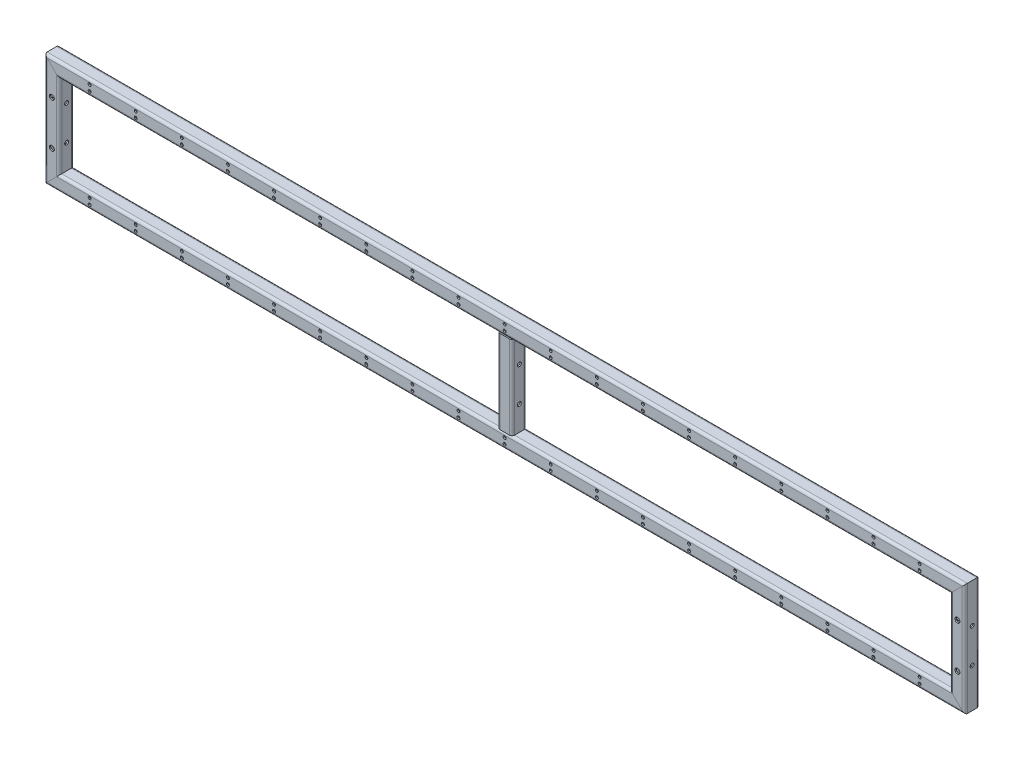
from build123d import *

# Parameters (mm, degrees)
STRUCTURAL_MEMBER1_DEPTH      = 222.213203436
STRUCTURAL_MEMBER1_DEPTH_BACK = 22.213203436
STRUCTURAL_MEMBER1_2_DEPTH    = 1890.426406871
STRUCTURAL_MEMBER1_3_DEPTH    = 244.426406871
STRUCTURAL_MEMBER1_4_DEPTH    = 1890.426406871
STRUCTURAL_MEMBER2_DEPTH      = 200
SKETCH13_R                    = 3
SKETCH13_R_2                  = 3.001929864
CUT_EXTRUDE1_DEPTH            = 1922.588145259
LPATTERN1_COUNT               = 19
LPATTERN1_PITCH               = 94
SKETCH15_R                    = 5
CUT_EXTRUDE2_DEPTH            = 1922.588145259
SKETCH17_R                    = 4
CUT_EXTRUDE3_DEPTH            = 1922.41250126


with BuildPart() as part:
    # Sketch11 → Structural Member1 (new, two sides: drawn at the far end of the back side and taken through both)
    with BuildSketch(Plane(origin=(-1861, -200, 0), x_dir=(1, 0, 0), z_dir=(0, -1, 0)).offset(-STRUCTURAL_MEMBER1_DEPTH_BACK)):
        with BuildLine():
            Line((-9.8, -15), (9.8, -15))
            ThreePointArc((9.8, -15), (13.476955262, -13.476955262), (15, -9.8))
            Line((15, -9.8), (15, 9.8))
            ThreePointArc((15, 9.8), (13.476955262, 13.476955262), (9.8, 15))
            Line((9.8, 15), (-9.8, 15))
            ThreePointArc((-9.8, 15), (-13.476955262, 13.476955262), (-15, 9.8))
            Line((-15, 9.8), (-15, -9.8))
            ThreePointArc((-15, -9.8), (-13.476955262, -13.476955262), (-9.8, -15))
        make_face()
        with BuildLine():
            Line((-9.8, -12.4), (9.8, -12.4))
            ThreePointArc((9.8, -12.4), (11.638477631, -11.638477631), (12.4, -9.8))
            Line((12.4, -9.8), (12.4, 9.8))
            ThreePointArc((12.4, 9.8), (11.638477631, 11.638477631), (9.8, 12.4))
            Line((9.8, 12.4), (-9.8, 12.4))
            ThreePointArc((-9.8, 12.4), (-11.638477631, 11.638477631), (-12.4, 9.8))
            Line((-12.4, 9.8), (-12.4, -9.8))
            ThreePointArc((-12.4, -9.8), (-11.638477631, -11.638477631), (-9.8, -12.4))
        make_face(mode=Mode.SUBTRACT)
    extrude(amount=STRUCTURAL_MEMBER1_DEPTH + STRUCTURAL_MEMBER1_DEPTH_BACK)

    # Structural Member1 mitre 1
    split(bisect_by=Plane(origin=(-1861, -200, 0), x_dir=(0.707106781, -0.707106781, 0), z_dir=(-0.707106781, -0.707106781, 0)), keep=Keep.TOP)

    # Structural Member1 mitre 2
    split(bisect_by=Plane(origin=(-1861, -400, 0), x_dir=(-0.707106781, -0.707106781, 0), z_dir=(-0.707106781, 0.707106781, 0)), keep=Keep.TOP)


with BuildPart() as body_2:
    # Sketch11 on segment 2 (carried to segment 2) → Structural Member1 2 (new body)
    with BuildSketch(Plane(origin=(-1883.213203436, -400, 0), x_dir=(0, 1, 0), z_dir=(1, 0, 0))):
        with BuildLine():
            Line((-9.8, -15), (9.8, -15))
            ThreePointArc((9.8, -15), (13.476955262, -13.476955262), (15, -9.8))
            Line((15, -9.8), (15, 9.8))
            ThreePointArc((15, 9.8), (13.476955262, 13.476955262), (9.8, 15))
            Line((9.8, 15), (-9.8, 15))
            ThreePointArc((-9.8, 15), (-13.476955262, 13.476955262), (-15, 9.8))
            Line((-15, 9.8), (-15, -9.8))
            ThreePointArc((-15, -9.8), (-13.476955262, -13.476955262), (-9.8, -15))
        make_face()
        with BuildLine():
            Line((-9.8, -12.4), (9.8, -12.4))
            ThreePointArc((9.8, -12.4), (11.638477631, -11.638477631), (12.4, -9.8))
            Line((12.4, -9.8), (12.4, 9.8))
            ThreePointArc((12.4, 9.8), (11.638477631, 11.638477631), (9.8, 12.4))
            Line((9.8, 12.4), (-9.8, 12.4))
            ThreePointArc((-9.8, 12.4), (-11.638477631, 11.638477631), (-12.4, 9.8))
            Line((-12.4, 9.8), (-12.4, -9.8))
            ThreePointArc((-12.4, -9.8), (-11.638477631, -11.638477631), (-9.8, -12.4))
        make_face(mode=Mode.SUBTRACT)
    extrude(amount=STRUCTURAL_MEMBER1_2_DEPTH)

    # Structural Member1 2 mitre 1
    split(bisect_by=Plane(origin=(-15, -400, 0), x_dir=(0.707106781, -0.707106781, 0), z_dir=(-0.707106781, -0.707106781, 0)), keep=Keep.TOP)

    # Structural Member1 2 mitre 2
    split(bisect_by=Plane(origin=(-1861, -400, 0), x_dir=(0.707106781, 0.707106781, 0), z_dir=(0.707106781, -0.707106781, 0)), keep=Keep.TOP)


with BuildPart() as body_3:
    # Sketch11 on segment 3 (carried to segment 3) → Structural Member1 3 (new body)
    with BuildSketch(Plane(origin=(-15, -422.213203436, 0), x_dir=(-1, 0, 0), z_dir=(0, 1, 0))):
        with BuildLine():
            Line((-9.8, -15), (9.8, -15))
            ThreePointArc((9.8, -15), (13.476955262, -13.476955262), (15, -9.8))
            Line((15, -9.8), (15, 9.8))
            ThreePointArc((15, 9.8), (13.476955262, 13.476955262), (9.8, 15))
            Line((9.8, 15), (-9.8, 15))
            ThreePointArc((-9.8, 15), (-13.476955262, 13.476955262), (-15, 9.8))
            Line((-15, 9.8), (-15, -9.8))
            ThreePointArc((-15, -9.8), (-13.476955262, -13.476955262), (-9.8, -15))
        make_face()
        with BuildLine():
            Line((-9.8, -12.4), (9.8, -12.4))
            ThreePointArc((9.8, -12.4), (11.638477631, -11.638477631), (12.4, -9.8))
            Line((12.4, -9.8), (12.4, 9.8))
            ThreePointArc((12.4, 9.8), (11.638477631, 11.638477631), (9.8, 12.4))
            Line((9.8, 12.4), (-9.8, 12.4))
            ThreePointArc((-9.8, 12.4), (-11.638477631, 11.638477631), (-12.4, 9.8))
            Line((-12.4, 9.8), (-12.4, -9.8))
            ThreePointArc((-12.4, -9.8), (-11.638477631, -11.638477631), (-9.8, -12.4))
        make_face(mode=Mode.SUBTRACT)
    extrude(amount=STRUCTURAL_MEMBER1_3_DEPTH)

    # Structural Member1 3 mitre 1
    split(bisect_by=Plane(origin=(-15, -200, 0), x_dir=(0.707106781, 0.707106781, 0), z_dir=(0.707106781, -0.707106781, 0)), keep=Keep.TOP)

    # Structural Member1 3 mitre 2
    split(bisect_by=Plane(origin=(-15, -400, 0), x_dir=(-0.707106781, 0.707106781, 0), z_dir=(0.707106781, 0.707106781, 0)), keep=Keep.TOP)


with BuildPart() as body_4:
    # Sketch11 on segment 4 (carried to segment 4) → Structural Member1 4 (new body)
    with BuildSketch(Plane(origin=(7.213203436, -200, 0), x_dir=(0, -1, 0), z_dir=(-1, 0, 0))):
        with BuildLine():
            Line((-9.8, -15), (9.8, -15))
            ThreePointArc((9.8, -15), (13.476955262, -13.476955262), (15, -9.8))
            Line((15, -9.8), (15, 9.8))
            ThreePointArc((15, 9.8), (13.476955262, 13.476955262), (9.8, 15))
            Line((9.8, 15), (-9.8, 15))
            ThreePointArc((-9.8, 15), (-13.476955262, 13.476955262), (-15, 9.8))
            Line((-15, 9.8), (-15, -9.8))
            ThreePointArc((-15, -9.8), (-13.476955262, -13.476955262), (-9.8, -15))
        make_face()
        with BuildLine():
            Line((-9.8, -12.4), (9.8, -12.4))
            ThreePointArc((9.8, -12.4), (11.638477631, -11.638477631), (12.4, -9.8))
            Line((12.4, -9.8), (12.4, 9.8))
            ThreePointArc((12.4, 9.8), (11.638477631, 11.638477631), (9.8, 12.4))
            Line((9.8, 12.4), (-9.8, 12.4))
            ThreePointArc((-9.8, 12.4), (-11.638477631, 11.638477631), (-12.4, 9.8))
            Line((-12.4, 9.8), (-12.4, -9.8))
            ThreePointArc((-12.4, -9.8), (-11.638477631, -11.638477631), (-9.8, -12.4))
        make_face(mode=Mode.SUBTRACT)
    extrude(amount=STRUCTURAL_MEMBER1_4_DEPTH)

    # Structural Member1 4 mitre 1
    split(bisect_by=Plane(origin=(-15, -200, 0), x_dir=(-0.707106781, -0.707106781, 0), z_dir=(-0.707106781, 0.707106781, 0)), keep=Keep.TOP)

    # Structural Member1 4 mitre 2
    split(bisect_by=Plane(origin=(-1861, -200, 0), x_dir=(-0.707106781, 0.707106781, 0), z_dir=(0.707106781, 0.707106781, 0)), keep=Keep.TOP)


with BuildPart() as part_1:
    add(part.part)

    # Structural Member1 as one body: union body 2, body 3, body 4
    add(body_2.part)
    add(body_3.part)
    add(body_4.part)

    # Sketch13 → Cut-Extrude1 (cut, through all)
    with BuildSketch(Plane.XY.offset(15)):
        with Locations((-92, -194)):
            Circle(SKETCH13_R)
        with Locations((-92, -206)):
            Circle(SKETCH13_R)
        with Locations((-92, -406)):
            Circle(SKETCH13_R)
        with Locations((-92, -394)):
            Circle(SKETCH13_R_2)
    cut_extrude1 = extrude(amount=-CUT_EXTRUDE1_DEPTH, mode=Mode.SUBTRACT)

    # LPattern1: Cut-Extrude1 ×19
    with Locations(*[(-i * LPATTERN1_PITCH, 0, 0) for i in range(1, LPATTERN1_COUNT)]):
        add(cut_extrude1, mode=Mode.SUBTRACT)

    # Sketch15 → Cut-Extrude2 (cut, through all)
    with BuildSketch(Plane(origin=(0, 0, -15), x_dir=(-1, 0, 0), z_dir=(0, 0, -1))):
        with Locations((15, -255)):
            Circle(SKETCH15_R)
        with Locations((15, -345)):
            Circle(SKETCH15_R)
    cut_extrude2 = extrude(amount=-CUT_EXTRUDE2_DEPTH, mode=Mode.SUBTRACT)

    # Mirror1: Cut-Extrude2 across plane
    add(cut_extrude2.mirror(Plane(origin=(-938, 0, 0), x_dir=(0, 0, 1), z_dir=(1, 0, 0))), mode=Mode.SUBTRACT)


with BuildPart() as body_2_2:
    # Sketch12 → Structural Member2 (new body)
    with BuildSketch(Plane(origin=(-938, -200, 0), x_dir=(1, 0, 0), z_dir=(0, -1, 0))):
        with BuildLine():
            Line((-9.8, -15), (9.8, -15))
            ThreePointArc((9.8, -15), (13.476955262, -13.476955262), (15, -9.8))
            Line((15, -9.8), (15, 9.8))
            ThreePointArc((15, 9.8), (13.476955262, 13.476955262), (9.8, 15))
            Line((9.8, 15), (-9.8, 15))
            ThreePointArc((-9.8, 15), (-13.476955262, 13.476955262), (-15, 9.8))
            Line((-15, 9.8), (-15, -9.8))
            ThreePointArc((-15, -9.8), (-13.476955262, -13.476955262), (-9.8, -15))
        make_face()
        with BuildLine():
            Line((-9.8, -12.4), (9.8, -12.4))
            ThreePointArc((9.8, -12.4), (11.638477631, -11.638477631), (12.4, -9.8))
            Line((12.4, -9.8), (12.4, 9.8))
            ThreePointArc((12.4, 9.8), (11.638477631, 11.638477631), (9.8, 12.4))
            Line((9.8, 12.4), (-9.8, 12.4))
            ThreePointArc((-9.8, 12.4), (-11.638477631, 11.638477631), (-12.4, 9.8))
            Line((-12.4, 9.8), (-12.4, -9.8))
            ThreePointArc((-12.4, -9.8), (-11.638477631, -11.638477631), (-9.8, -12.4))
        make_face(mode=Mode.SUBTRACT)
    extrude(amount=STRUCTURAL_MEMBER2_DEPTH)

    # Trim/Extend1
    split(bisect_by=Plane(origin=(-938, -215, 0), x_dir=(1, 0, 0), z_dir=(0, -1, 0)), keep=Keep.TOP)

    # Trim_Extend1 3
    split(bisect_by=Plane(origin=(-938, -385, 0), x_dir=(-1, 0, 0), z_dir=(0, 1, 0)), keep=Keep.TOP)


with BuildPart() as cut_extrude3_tool:
    # Sketch17 → Cut-Extrude3 (new, through all)
    with BuildSketch(Plane(origin=(0, 0, 0), x_dir=(0, 0, -1), z_dir=(1, 0, 0))):
        with Locations((0, -265)):
            Circle(SKETCH17_R)
        with Locations((0, -335)):
            Circle(SKETCH17_R)
    extrude(amount=-CUT_EXTRUDE3_DEPTH)


with BuildPart() as part_2:
    add(part_1.part)

    # Cut-Extrude3: cut by cut_extrude3_tool
    add(cut_extrude3_tool.part, mode=Mode.SUBTRACT)


with BuildPart() as body_2_2_1:
    add(body_2_2.part)

    # Cut-Extrude3: cut by cut_extrude3_tool
    add(cut_extrude3_tool.part, mode=Mode.SUBTRACT)


solid = Compound([part_2.part, body_2_2_1.part])
